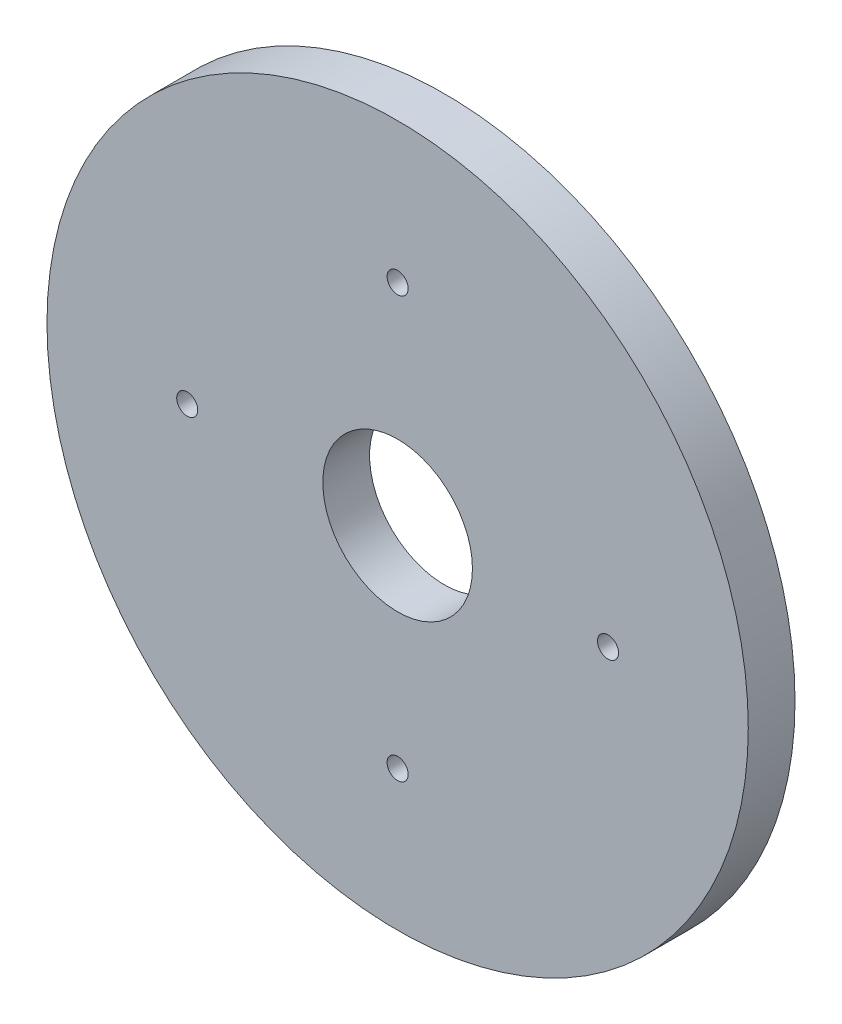
from build123d import *

# Parameters (mm, degrees)
SKETCH1_R           = 75
BOSS_EXTRUDE1_DEPTH = 10
SKETCH2_R           = 16
CUT_EXTRUDE1_DEPTH  = 30
SKETCH3_R           = 2.25
CUT_EXTRUDE2_DEPTH  = 30
SKETCH4_R           = 2.25
CUT_EXTRUDE3_DEPTH  = 30
SKETCH5_R           = 2.25
CUT_EXTRUDE4_DEPTH  = 30
SKETCH6_R           = 2.25
CUT_EXTRUDE5_DEPTH  = 30


with BuildPart() as part:
    # Sketch1 → Boss-Extrude1 (new body)
    with BuildSketch(Plane.XY.offset(113)):
        with Locations((300, 300)):
            Circle(SKETCH1_R)
    extrude(amount=BOSS_EXTRUDE1_DEPTH)

    # Sketch2 → Cut-Extrude1 (cut)
    with BuildSketch(Plane.XY.offset(123)):
        with Locations((300, 300)):
            Circle(SKETCH2_R)
    extrude(amount=-CUT_EXTRUDE1_DEPTH, mode=Mode.SUBTRACT)

    # Sketch3 → Cut-Extrude2 (cut)
    with BuildSketch(Plane.XY.offset(123)):
        with Locations((345, 300)):
            Circle(SKETCH3_R)
    extrude(amount=-CUT_EXTRUDE2_DEPTH, mode=Mode.SUBTRACT)

    # Sketch4 → Cut-Extrude3 (cut)
    with BuildSketch(Plane.XY.offset(123)):
        with Locations((255, 300)):
            Circle(SKETCH4_R)
    extrude(amount=-CUT_EXTRUDE3_DEPTH, mode=Mode.SUBTRACT)

    # Sketch5 → Cut-Extrude4 (cut)
    with BuildSketch(Plane.XY.offset(123)):
        with Locations((300, 345)):
            Circle(SKETCH5_R)
    extrude(amount=-CUT_EXTRUDE4_DEPTH, mode=Mode.SUBTRACT)

    # Sketch6 → Cut-Extrude5 (cut)
    with BuildSketch(Plane.XY.offset(123)):
        with Locations((300, 255)):
            Circle(SKETCH6_R)
    extrude(amount=-CUT_EXTRUDE5_DEPTH, mode=Mode.SUBTRACT)


solid = part.part
